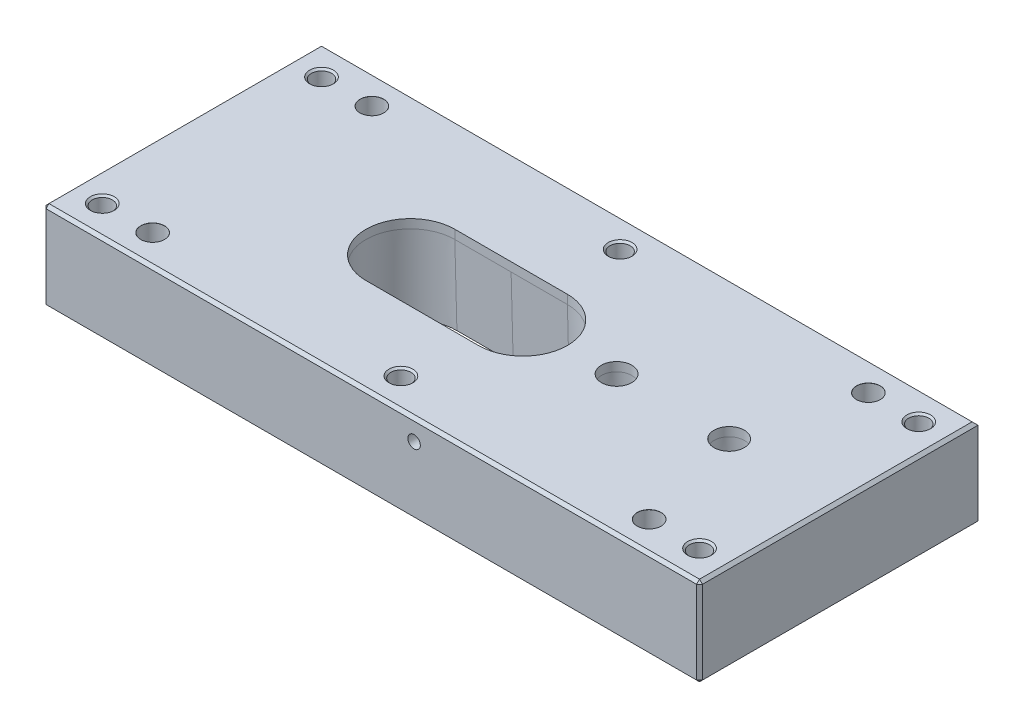
from build123d import *

# Parameters (mm, degrees)
SKETCH1_W                      = 221.6
SKETCH1_H                      = 94
BOSS_EXTRUDE1_DEPTH            = 30
SKETCH2_R                      = 5.12
CUT_EXTRUDE1_DEPTH             = 125.038864877
CHAMFER1_SIZE                  = 1
M5_TAPPED_HOLE1_D              = 4.2
M5_TAPPED_HOLE1_DEPTH          = 14
M5_TAPPED_HOLE1_TIP            = 1.2618073
M8_TAPPED_HOLE1_AT_2_COUNT     = 2
M8_TAPPED_HOLE1_AT_2_PITCH     = 74
M8_TAPPED_HOLE1_AT_3_COUNT     = 2
M8_TAPPED_HOLE1_AT_3_PITCH     = 214.752322455
M8_TAPPED_HOLE1_AT_4_COUNT     = 2
M8_TAPPED_HOLE1_AT_4_PITCH     = 201.6
M8_TAPPED_HOLE1_AT_5_COUNT     = 2
M8_TAPPED_HOLE1_AT_5_PITCH     = 100.8
M8_TAPPED_HOLE1_AT_6_COUNT     = 2
M8_TAPPED_HOLE1_AT_6_PITCH     = 125.046551332
F_8_0MM_DOWEL_HOLE1_AT_2_COUNT = 2
F_8_0MM_DOWEL_HOLE1_AT_2_PITCH = 183.209606735


with BuildPart() as part:
    # Sketch1 → Boss-Extrude1 (new body)
    with BuildSketch(Plane(origin=(0, 0, 0), x_dir=(1, 0, 0), z_dir=(0, 1, 0))):
        Rectangle(SKETCH1_W, SKETCH1_H)
    extrude(amount=-BOSS_EXTRUDE1_DEPTH)

    # Sketch2 → Cut-Extrude1 (cut, through all)
    with BuildSketch(Plane(origin=(0, 0, 0), x_dir=(1, 0, 0), z_dir=(0, 1, 0))):
        with Locations(Location((35.8, 0, 0), (0, 0, 270))):
            Circle(SKETCH2_R)
        with Locations(Location((73.8, 0, 0), (0, 0, 270))):
            Circle(SKETCH2_R)
        with BuildLine():
            Line((-33.8, 15), (4.2, 15))
            ThreePointArc((4.2, 15), (19.2, 0), (4.2, -15))
            Line((4.2, -15), (-33.8, -15))
            ThreePointArc((-33.8, -15), (-48.8, 0), (-33.8, 15))
        make_face()
    extrude(amount=-CUT_EXTRUDE1_DEPTH, mode=Mode.SUBTRACT)

    # Cut-Sweep1: sweep along a curve in space
    with BuildLine() as cut_sweep1_path:
        ThreePointArc((-33.8, 0, 15), (-48.8, 0, 0), (-33.8, 0, -15))
        Line((-33.8, 0, -15), (4.2, 0, -15))
        ThreePointArc((4.2, 0, -15), (19.2, 0, 0), (4.2, 0, 15))
        Line((4.2, 0, 15), (-33.8, 0, 15))
    # Sketch3 → Cut-Sweep1 (sweep, cut)
    with BuildSketch(Plane(origin=(-14.8, 0, 0), x_dir=(0, 0, -1), z_dir=(1, 0, 0))):
        Polygon((15, -3), (15.707019882, -30), (15, -30), align=None)
    sweep(path=cut_sweep1_path.line, mode=Mode.SUBTRACT)

    # Cut-Sweep2: sweep along a curve in space
    with BuildLine() as cut_sweep2_path:
        ThreePointArc((35.8, 0, 5.12), (39.42038672, 0, 3.62038672), (40.92, 0, 0))
        ThreePointArc((40.92, 0, 0), (39.42038672, 0, -3.62038672), (35.8, 0, -5.12))
        ThreePointArc((35.8, 0, -5.12), (32.17961328, 0, -3.62038672), (30.68, 0, 0))
        ThreePointArc((30.68, 0, 0), (32.17961328, 0, 3.62038672), (35.8, 0, 5.12))
    # Sketch5 → Cut-Sweep2 (sweep, cut)
    with BuildSketch(Plane.XY):
        Polygon((40.92, -3), (41.627019882, -30), (40.92, -30), align=None)
    sweep(path=cut_sweep2_path.line, mode=Mode.SUBTRACT)

    # Cut-Sweep3: sweep along a curve in space
    with BuildLine() as cut_sweep3_path:
        ThreePointArc((73.8, 0, 5.12), (77.42038672, 0, 3.62038672), (78.92, 0, 0))
        ThreePointArc((78.92, 0, 0), (77.42038672, 0, -3.62038672), (73.8, 0, -5.12))
        ThreePointArc((73.8, 0, -5.12), (70.17961328, 0, -3.62038672), (68.68, 0, 0))
        ThreePointArc((68.68, 0, 0), (70.17961328, 0, 3.62038672), (73.8, 0, 5.12))
    # Sketch9 → Cut-Sweep3 (sweep, cut)
    with BuildSketch(Plane.XY):
        Polygon((78.92, -3), (79.627019882, -30), (78.92, -30), align=None)
    sweep(path=cut_sweep3_path.line, mode=Mode.SUBTRACT)

    # Chamfer1
    chamfer1_edges = [part.edges().sort_by_distance(p)[0] for p in [
        (-110.8, -30, 0),
        (0, -30, 47),
        (110.8, -30, 0),
        (0, 0, 47),
        (-110.8, 0, 0),
        (0, 0, -47),
        (110.8, 0, 0),
        (110.8, -15, 47),
        (-110.8, -15, 47),
        (-110.8, -15, -47),
        (0, -30, -47),
    ]]
    chamfer(chamfer1_edges, length=CHAMFER1_SIZE)

    # M5 Tapped Hole1
    with Locations(Plane.XY.offset(47)):
        with Locations((14.45, -7)):
            Hole(M5_TAPPED_HOLE1_D / 2, depth=M5_TAPPED_HOLE1_DEPTH)
            with Locations((0, 0, -(M5_TAPPED_HOLE1_DEPTH + M5_TAPPED_HOLE1_TIP / 2))):  # 118° drill point
                Cone(0, M5_TAPPED_HOLE1_D / 2, M5_TAPPED_HOLE1_TIP, mode=Mode.SUBTRACT)

    # Sketch15 → M8 Tapped Hole1 (revolve, cut)
    with BuildSketch(Plane(origin=(-100.8, 0, 37), x_dir=(0, 0, 1), z_dir=(1, 0, 0))):
        Polygon((0, 0), (0, 30), (4.025, 30), (3.4, 29.375), (3.4, 0.625), (4.025, 0), align=None)
    m8_tapped_hole1 = revolve(axis=Axis((-100.8, 6.35, 37), (0, -1, 0)), mode=Mode.SUBTRACT)

    # M8 Tapped Hole1 at 2: M8 Tapped Hole1 ×2
    with Locations(*[(0, 0, -i * M8_TAPPED_HOLE1_AT_2_PITCH) for i in range(1, M8_TAPPED_HOLE1_AT_2_COUNT)]):
        add(m8_tapped_hole1, mode=Mode.SUBTRACT)

    # M8 Tapped Hole1 at 3: M8 Tapped Hole1 ×2
    with Locations(*[Vector(0.9387558546280332, 0, -0.34458300219481375) * (i * M8_TAPPED_HOLE1_AT_3_PITCH) for i in range(1, M8_TAPPED_HOLE1_AT_3_COUNT)]):
        add(m8_tapped_hole1, mode=Mode.SUBTRACT)

    # M8 Tapped Hole1 at 4: M8 Tapped Hole1 ×2
    with Locations(*[(i * M8_TAPPED_HOLE1_AT_4_PITCH, 0, 0) for i in range(1, M8_TAPPED_HOLE1_AT_4_COUNT)]):
        add(m8_tapped_hole1, mode=Mode.SUBTRACT)

    # M8 Tapped Hole1 at 5: M8 Tapped Hole1 ×2
    with Locations(*[(i * M8_TAPPED_HOLE1_AT_5_PITCH, 0, 0) for i in range(1, M8_TAPPED_HOLE1_AT_5_COUNT)]):
        add(m8_tapped_hole1, mode=Mode.SUBTRACT)

    # M8 Tapped Hole1 at 6: M8 Tapped Hole1 ×2
    with Locations(*[Vector(0.8060997998454218, 0, -0.591779614965885) * (i * M8_TAPPED_HOLE1_AT_6_PITCH) for i in range(1, M8_TAPPED_HOLE1_AT_6_COUNT)]):
        add(m8_tapped_hole1, mode=Mode.SUBTRACT)

    # Sketch17 → Ø8.0mm Dowel Hole1 (revolve, cut)
    with BuildSketch(Plane(origin=(-83.8, 0, 37), x_dir=(0, 0, 1), z_dir=(1, 0, 0))):
        Polygon((0, 0), (0, 30), (4.025, 30), (4, 29.975), (4, 0.025), (4.025, 0), align=None)
    f_8_0mm_dowel_hole1 = revolve(axis=Axis((-83.8, 6.35, 37), (0, -1, 0)), mode=Mode.SUBTRACT)

    # Ø8.0mm Dowel Hole1 at 2: Ø8.0mm Dowel Hole1 ×2
    with Locations(*[Vector(0.9147991908656035, 0, -0.40390895062085114) * (i * F_8_0MM_DOWEL_HOLE1_AT_2_PITCH) for i in range(1, F_8_0MM_DOWEL_HOLE1_AT_2_COUNT)]):
        add(f_8_0mm_dowel_hole1, mode=Mode.SUBTRACT)

    # Mirror1: Ø8.0mm Dowel Hole1 across plane
    add(f_8_0mm_dowel_hole1.mirror(Plane.XY), mode=Mode.SUBTRACT)

    # Mirror1 copy 1 sketch → Mirror1 copy 1 (revolve, cut)
    with BuildSketch(Plane(origin=(83.8, 0, 37), x_dir=(0, 0, -1), z_dir=(1, 0, 0))):
        Polygon((0, 0), (0, -30), (4.025, -30), (4, -29.975), (4, -0.025), (4.025, 0), align=None)
    revolve(axis=Axis((83.8, 6.35, 37), (0, 1, 0)), mode=Mode.SUBTRACT)


solid = part.part
